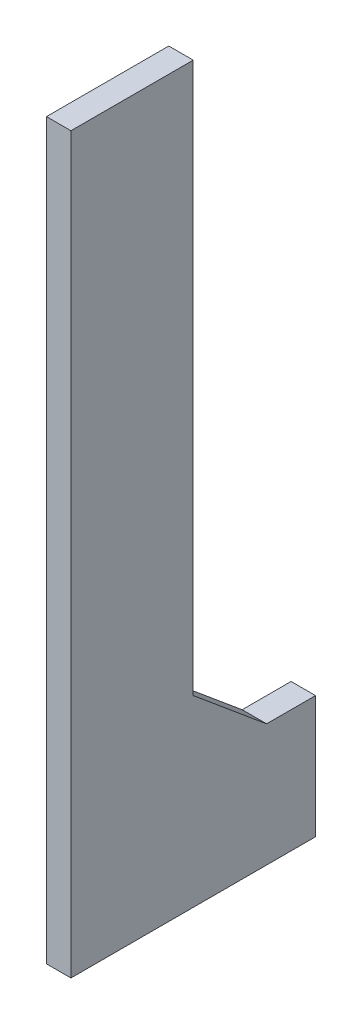
from build123d import *

# Parameters (mm, degrees)
EXTRUDE_407_DEPTH = 10


with BuildPart() as part:
    # Эскиз1 → Extrude 407 (new body)
    with BuildSketch(Plane(origin=(0, 0, 0), x_dir=(0, 0, -1), z_dir=(1, 0, 0))):
        Polygon((0, 0), (100, 0), (100, 50), (80, 50), (50, 75), (50, 300), (0, 300), align=None)
    extrude(amount=EXTRUDE_407_DEPTH)


solid = part.part
